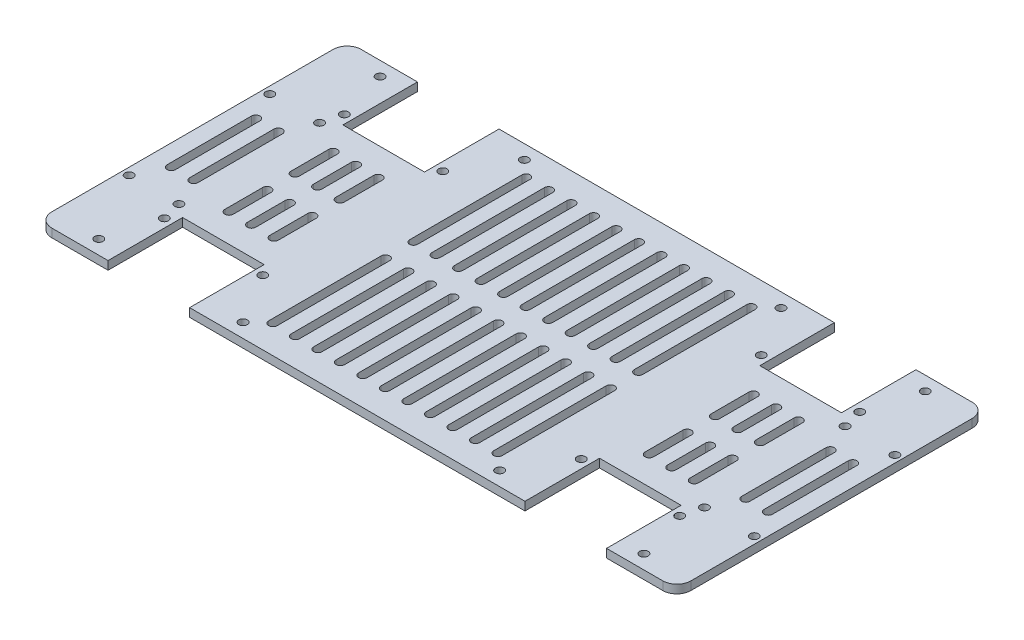
from build123d import *

# Parameters (mm, degrees)
SKETCH_1_R      = 1.5
EXTRUDE_2_DEPTH = 3
FILLET_1_R      = 5


with BuildPart() as part:
    # 草图1 → 凸台-拉伸2 (new body)
    with BuildSketch(Plane(origin=(0, 0, 0), x_dir=(1, 0, 0), z_dir=(0, 1, 0))):
        Polygon((-51.097347914, -170.742252719), (-51.097347914, -197.242252719), (68.132652086, -197.242252719), (68.132652086, -170.742252719), (97.132652086, -170.742252719), (97.132652086, -197.242252719), (122.132652086, -197.242252719), (122.132652086, -87.242252719), (97.132652086, -87.242252719), (97.132652086, -113.742252719), (68.132652086, -113.742252719), (68.132652086, -87.242252719), (-51.097347914, -87.242252719), (-51.097347914, -113.742252719), (-80.097347914, -113.742252719), (-80.097347914, -87.242252719), (-105.097347914, -87.242252719), (-105.097347914, -197.242252719), (-80.097347914, -197.242252719), (-80.097347914, -170.742252719), align=None)
        with Locations(Location((-88.387347914, -192.242252719, 0), (0, 0, 270))):
            Circle(SKETCH_1_R, mode=Mode.SUBTRACT)
        with Locations(Location((-37.097347914, -192.242252719, 0), (0, 0, 270))):
            Circle(SKETCH_1_R, mode=Mode.SUBTRACT)
        with Locations(Location((-102.597347914, -167.242252719, 0), (0, 0, 270))):
            Circle(SKETCH_1_R, mode=Mode.SUBTRACT)
        with Locations(Location((-84.897347914, -167.242252719, 0), (0, 0, 270))):
            Circle(SKETCH_1_R, mode=Mode.SUBTRACT)
        with BuildLine():
            ThreePointArc((-75.097347914, -147.242252719), (-73.597347914, -145.742252719), (-72.097347914, -147.242252719))
            Line((-72.097347914, -147.242252719), (-72.097347914, -160.742252719))
            ThreePointArc((-72.097347914, -160.742252719), (-73.597347914, -162.242252719), (-75.097347914, -160.742252719))
            Line((-75.097347914, -160.742252719), (-75.097347914, -147.242252719))
        make_face(mode=Mode.SUBTRACT)
        with BuildLine():
            ThreePointArc((-67.097347914, -147.242252719), (-65.597347914, -145.742252719), (-64.097347914, -147.242252719))
            Line((-64.097347914, -147.242252719), (-64.097347914, -160.742252719))
            ThreePointArc((-64.097347914, -160.742252719), (-65.597347914, -162.242252719), (-67.097347914, -160.742252719))
            Line((-67.097347914, -160.742252719), (-67.097347914, -147.242252719))
        make_face(mode=Mode.SUBTRACT)
        with BuildLine():
            ThreePointArc((-59.097347914, -147.242252719), (-57.597347914, -145.742252719), (-56.097347914, -147.242252719))
            Line((-56.097347914, -147.242252719), (-56.097347914, -160.742252719))
            ThreePointArc((-56.097347914, -160.742252719), (-57.597347914, -162.242252719), (-59.097347914, -160.742252719))
            Line((-59.097347914, -160.742252719), (-59.097347914, -147.242252719))
        make_face(mode=Mode.SUBTRACT)
        with BuildLine():
            ThreePointArc((-32.982347914, -147.242252719), (-31.482347914, -145.742252719), (-29.982347914, -147.242252719))
            Line((-29.982347914, -147.242252719), (-29.982347914, -187.242252719))
            ThreePointArc((-29.982347914, -187.242252719), (-31.482347914, -188.742252719), (-32.982347914, -187.242252719))
            Line((-32.982347914, -187.242252719), (-32.982347914, -147.242252719))
        make_face(mode=Mode.SUBTRACT)
        with BuildLine():
            ThreePointArc((-24.982347914, -147.242252719), (-23.482347914, -145.742252719), (-21.982347914, -147.242252719))
            Line((-21.982347914, -147.242252719), (-21.982347914, -187.242252719))
            ThreePointArc((-21.982347914, -187.242252719), (-23.482347914, -188.742252719), (-24.982347914, -187.242252719))
            Line((-24.982347914, -187.242252719), (-24.982347914, -147.242252719))
        make_face(mode=Mode.SUBTRACT)
        with BuildLine():
            ThreePointArc((-16.982347914, -147.242252719), (-15.482347914, -145.742252719), (-13.982347914, -147.242252719))
            Line((-13.982347914, -147.242252719), (-13.982347914, -187.242252719))
            ThreePointArc((-13.982347914, -187.242252719), (-15.482347914, -188.742252719), (-16.982347914, -187.242252719))
            Line((-16.982347914, -187.242252719), (-16.982347914, -147.242252719))
        make_face(mode=Mode.SUBTRACT)
        with BuildLine():
            ThreePointArc((-8.982347914, -147.242252719), (-7.482347914, -145.742252719), (-5.982347914, -147.242252719))
            Line((-5.982347914, -147.242252719), (-5.982347914, -187.242252719))
            ThreePointArc((-5.982347914, -187.242252719), (-7.482347914, -188.742252719), (-8.982347914, -187.242252719))
            Line((-8.982347914, -187.242252719), (-8.982347914, -147.242252719))
        make_face(mode=Mode.SUBTRACT)
        with BuildLine():
            ThreePointArc((-0.982347914, -147.242252719), (0.517652086, -145.742252719), (2.017652086, -147.242252719))
            Line((2.017652086, -147.242252719), (2.017652086, -187.242252719))
            ThreePointArc((2.017652086, -187.242252719), (0.517652086, -188.742252719), (-0.982347914, -187.242252719))
            Line((-0.982347914, -187.242252719), (-0.982347914, -147.242252719))
        make_face(mode=Mode.SUBTRACT)
        with Locations(Location((54.132652086, -192.242252719, 0), (0, 0, 270))):
            Circle(SKETCH_1_R, mode=Mode.SUBTRACT)
        with Locations(Location((105.422652086, -192.242252719, 0), (0, 0, 270))):
            Circle(SKETCH_1_R, mode=Mode.SUBTRACT)
        with BuildLine():
            ThreePointArc((7.017652086, -147.242252719), (8.517652086, -145.742252719), (10.017652086, -147.242252719))
            Line((10.017652086, -147.242252719), (10.017652086, -187.242252719))
            ThreePointArc((10.017652086, -187.242252719), (8.517652086, -188.742252719), (7.017652086, -187.242252719))
            Line((7.017652086, -187.242252719), (7.017652086, -147.242252719))
        make_face(mode=Mode.SUBTRACT)
        with BuildLine():
            ThreePointArc((15.017652086, -147.242252719), (16.517652086, -145.742252719), (18.017652086, -147.242252719))
            Line((18.017652086, -147.242252719), (18.017652086, -187.242252719))
            ThreePointArc((18.017652086, -187.242252719), (16.517652086, -188.742252719), (15.017652086, -187.242252719))
            Line((15.017652086, -187.242252719), (15.017652086, -147.242252719))
        make_face(mode=Mode.SUBTRACT)
        with BuildLine():
            ThreePointArc((23.017652086, -147.242252719), (24.517652086, -145.742252719), (26.017652086, -147.242252719))
            Line((26.017652086, -147.242252719), (26.017652086, -187.242252719))
            ThreePointArc((26.017652086, -187.242252719), (24.517652086, -188.742252719), (23.017652086, -187.242252719))
            Line((23.017652086, -187.242252719), (23.017652086, -147.242252719))
        make_face(mode=Mode.SUBTRACT)
        with BuildLine():
            ThreePointArc((31.017652086, -147.242252719), (32.517652086, -145.742252719), (34.017652086, -147.242252719))
            Line((34.017652086, -147.242252719), (34.017652086, -187.242252719))
            ThreePointArc((34.017652086, -187.242252719), (32.517652086, -188.742252719), (31.017652086, -187.242252719))
            Line((31.017652086, -187.242252719), (31.017652086, -147.242252719))
        make_face(mode=Mode.SUBTRACT)
        with BuildLine():
            ThreePointArc((39.017652086, -147.242252719), (40.517652086, -145.742252719), (42.017652086, -147.242252719))
            Line((42.017652086, -147.242252719), (42.017652086, -187.242252719))
            ThreePointArc((42.017652086, -187.242252719), (40.517652086, -188.742252719), (39.017652086, -187.242252719))
            Line((39.017652086, -187.242252719), (39.017652086, -147.242252719))
        make_face(mode=Mode.SUBTRACT)
        with BuildLine():
            ThreePointArc((47.017652086, -147.242252719), (48.517652086, -145.742252719), (50.017652086, -147.242252719))
            Line((50.017652086, -147.242252719), (50.017652086, -187.242252719))
            ThreePointArc((50.017652086, -187.242252719), (48.517652086, -188.742252719), (47.017652086, -187.242252719))
            Line((47.017652086, -187.242252719), (47.017652086, -147.242252719))
        make_face(mode=Mode.SUBTRACT)
        with Locations(Location((101.932652086, -167.242252719, 0), (0, 0, 270))):
            Circle(SKETCH_1_R, mode=Mode.SUBTRACT)
        with Locations(Location((119.632652086, -167.242252719, 0), (0, 0, 270))):
            Circle(SKETCH_1_R, mode=Mode.SUBTRACT)
        with BuildLine():
            ThreePointArc((74.308572238, -147.242252719), (75.808572238, -145.742252719), (77.308572238, -147.242252719))
            Line((77.308572238, -147.242252719), (77.308572238, -160.742252719))
            ThreePointArc((77.308572238, -160.742252719), (75.808572238, -162.242252719), (74.308572238, -160.742252719))
            Line((74.308572238, -160.742252719), (74.308572238, -147.242252719))
        make_face(mode=Mode.SUBTRACT)
        with BuildLine():
            ThreePointArc((82.308572238, -147.242252719), (83.808572238, -145.742252719), (85.308572238, -147.242252719))
            Line((85.308572238, -147.242252719), (85.308572238, -160.742252719))
            ThreePointArc((85.308572238, -160.742252719), (83.808572238, -162.242252719), (82.308572238, -160.742252719))
            Line((82.308572238, -160.742252719), (82.308572238, -147.242252719))
        make_face(mode=Mode.SUBTRACT)
        with BuildLine():
            ThreePointArc((90.308572238, -147.242252719), (91.808572238, -145.742252719), (93.308572238, -147.242252719))
            Line((93.308572238, -147.242252719), (93.308572238, -160.742252719))
            ThreePointArc((93.308572238, -160.742252719), (91.808572238, -162.242252719), (90.308572238, -160.742252719))
            Line((90.308572238, -160.742252719), (90.308572238, -147.242252719))
        make_face(mode=Mode.SUBTRACT)
        with BuildLine():
            ThreePointArc((105.132652086, -127.242252719), (106.632652086, -125.742252719), (108.132652086, -127.242252719))
            Line((108.132652086, -127.242252719), (108.132652086, -157.242252719))
            ThreePointArc((108.132652086, -157.242252719), (106.632652086, -158.742252719), (105.132652086, -157.242252719))
            Line((105.132652086, -157.242252719), (105.132652086, -127.242252719))
        make_face(mode=Mode.SUBTRACT)
        with BuildLine():
            ThreePointArc((113.132652086, -127.242252719), (114.632652086, -125.742252719), (116.132652086, -127.242252719))
            Line((116.132652086, -127.242252719), (116.132652086, -157.242252719))
            ThreePointArc((116.132652086, -157.242252719), (114.632652086, -158.742252719), (113.132652086, -157.242252719))
            Line((113.132652086, -157.242252719), (113.132652086, -127.242252719))
        make_face(mode=Mode.SUBTRACT)
        with BuildLine():
            ThreePointArc((-99.097347914, -127.242252719), (-97.597347914, -125.742252719), (-96.097347914, -127.242252719))
            Line((-96.097347914, -127.242252719), (-96.097347914, -157.242252719))
            ThreePointArc((-96.097347914, -157.242252719), (-97.597347914, -158.742252719), (-99.097347914, -157.242252719))
            Line((-99.097347914, -157.242252719), (-99.097347914, -127.242252719))
        make_face(mode=Mode.SUBTRACT)
        with BuildLine():
            ThreePointArc((-91.097347914, -127.242252719), (-89.597347914, -125.742252719), (-88.097347914, -127.242252719))
            Line((-88.097347914, -127.242252719), (-88.097347914, -157.242252719))
            ThreePointArc((-88.097347914, -157.242252719), (-89.597347914, -158.742252719), (-91.097347914, -157.242252719))
            Line((-91.097347914, -157.242252719), (-91.097347914, -127.242252719))
        make_face(mode=Mode.SUBTRACT)
        with BuildLine():
            ThreePointArc((-72.097347914, -137.242252719), (-73.597347914, -138.742252719), (-75.097347914, -137.242252719))
            Line((-75.097347914, -137.242252719), (-75.097347914, -123.742252719))
            ThreePointArc((-75.097347914, -123.742252719), (-73.597347914, -122.242252719), (-72.097347914, -123.742252719))
            Line((-72.097347914, -123.742252719), (-72.097347914, -137.242252719))
        make_face(mode=Mode.SUBTRACT)
        with BuildLine():
            ThreePointArc((-64.097347914, -137.242252719), (-65.597347914, -138.742252719), (-67.097347914, -137.242252719))
            Line((-67.097347914, -137.242252719), (-67.097347914, -123.742252719))
            ThreePointArc((-67.097347914, -123.742252719), (-65.597347914, -122.242252719), (-64.097347914, -123.742252719))
            Line((-64.097347914, -123.742252719), (-64.097347914, -137.242252719))
        make_face(mode=Mode.SUBTRACT)
        with BuildLine():
            ThreePointArc((-56.097347914, -137.242252719), (-57.597347914, -138.742252719), (-59.097347914, -137.242252719))
            Line((-59.097347914, -137.242252719), (-59.097347914, -123.742252719))
            ThreePointArc((-59.097347914, -123.742252719), (-57.597347914, -122.242252719), (-56.097347914, -123.742252719))
            Line((-56.097347914, -123.742252719), (-56.097347914, -137.242252719))
        make_face(mode=Mode.SUBTRACT)
        with Locations(Location((-102.597347914, -117.242252719, 0), (0, 0, 270))):
            Circle(SKETCH_1_R, mode=Mode.SUBTRACT)
        with Locations(Location((-84.897347914, -117.242252719, 0), (0, 0, 270))):
            Circle(SKETCH_1_R, mode=Mode.SUBTRACT)
        with BuildLine():
            ThreePointArc((-32.899486364, -97.242252719), (-31.482347914, -95.825114269), (-30.065209464, -97.242252719))
            Line((-30.065209464, -97.242252719), (-30.065209464, -137.242252719))
            ThreePointArc((-30.065209464, -137.242252719), (-31.482347914, -138.659391169), (-32.899486364, -137.242252719))
            Line((-32.899486364, -137.242252719), (-32.899486364, -97.242252719))
        make_face(mode=Mode.SUBTRACT)
        with BuildLine():
            ThreePointArc((-24.982347914, -97.242252719), (-23.482347914, -95.742252719), (-21.982347914, -97.242252719))
            Line((-21.982347914, -97.242252719), (-21.982347914, -137.242252719))
            ThreePointArc((-21.982347914, -137.242252719), (-23.482347914, -138.742252719), (-24.982347914, -137.242252719))
            Line((-24.982347914, -137.242252719), (-24.982347914, -97.242252719))
        make_face(mode=Mode.SUBTRACT)
        with BuildLine():
            ThreePointArc((-16.982347914, -97.242252719), (-15.482347914, -95.742252719), (-13.982347914, -97.242252719))
            Line((-13.982347914, -97.242252719), (-13.982347914, -137.242252719))
            ThreePointArc((-13.982347914, -137.242252719), (-15.482347914, -138.742252719), (-16.982347914, -137.242252719))
            Line((-16.982347914, -137.242252719), (-16.982347914, -97.242252719))
        make_face(mode=Mode.SUBTRACT)
        with BuildLine():
            ThreePointArc((-8.982347914, -97.242252719), (-7.482347914, -95.742252719), (-5.982347914, -97.242252719))
            Line((-5.982347914, -97.242252719), (-5.982347914, -137.242252719))
            ThreePointArc((-5.982347914, -137.242252719), (-7.482347914, -138.742252719), (-8.982347914, -137.242252719))
            Line((-8.982347914, -137.242252719), (-8.982347914, -97.242252719))
        make_face(mode=Mode.SUBTRACT)
        with BuildLine():
            ThreePointArc((-0.982347914, -97.242252719), (0.517652086, -95.742252719), (2.017652086, -97.242252719))
            Line((2.017652086, -97.242252719), (2.017652086, -137.242252719))
            ThreePointArc((2.017652086, -137.242252719), (0.517652086, -138.742252719), (-0.982347914, -137.242252719))
            Line((-0.982347914, -137.242252719), (-0.982347914, -97.242252719))
        make_face(mode=Mode.SUBTRACT)
        with Locations(Location((-88.387347914, -92.242252719, 0), (0, 0, 270))):
            Circle(SKETCH_1_R, mode=Mode.SUBTRACT)
        with Locations(Location((-37.097347914, -92.242252719, 0), (0, 0, 270))):
            Circle(SKETCH_1_R, mode=Mode.SUBTRACT)
        with BuildLine():
            ThreePointArc((7.017652086, -97.242252719), (8.517652086, -95.742252719), (10.017652086, -97.242252719))
            Line((10.017652086, -97.242252719), (10.017652086, -137.242252719))
            ThreePointArc((10.017652086, -137.242252719), (8.517652086, -138.742252719), (7.017652086, -137.242252719))
            Line((7.017652086, -137.242252719), (7.017652086, -97.242252719))
        make_face(mode=Mode.SUBTRACT)
        with BuildLine():
            ThreePointArc((15.017652086, -97.242252719), (16.517652086, -95.742252719), (18.017652086, -97.242252719))
            Line((18.017652086, -97.242252719), (18.017652086, -137.242252719))
            ThreePointArc((18.017652086, -137.242252719), (16.517652086, -138.742252719), (15.017652086, -137.242252719))
            Line((15.017652086, -137.242252719), (15.017652086, -97.242252719))
        make_face(mode=Mode.SUBTRACT)
        with BuildLine():
            ThreePointArc((23.017652086, -97.242252719), (24.517652086, -95.742252719), (26.017652086, -97.242252719))
            Line((26.017652086, -97.242252719), (26.017652086, -137.242252719))
            ThreePointArc((26.017652086, -137.242252719), (24.517652086, -138.742252719), (23.017652086, -137.242252719))
            Line((23.017652086, -137.242252719), (23.017652086, -97.242252719))
        make_face(mode=Mode.SUBTRACT)
        with BuildLine():
            ThreePointArc((31.017652086, -97.242252719), (32.517652086, -95.742252719), (34.017652086, -97.242252719))
            Line((34.017652086, -97.242252719), (34.017652086, -137.242252719))
            ThreePointArc((34.017652086, -137.242252719), (32.517652086, -138.742252719), (31.017652086, -137.242252719))
            Line((31.017652086, -137.242252719), (31.017652086, -97.242252719))
        make_face(mode=Mode.SUBTRACT)
        with BuildLine():
            ThreePointArc((39.017652086, -97.242252719), (40.517652086, -95.742252719), (42.017652086, -97.242252719))
            Line((42.017652086, -97.242252719), (42.017652086, -137.242252719))
            ThreePointArc((42.017652086, -137.242252719), (40.517652086, -138.742252719), (39.017652086, -137.242252719))
            Line((39.017652086, -137.242252719), (39.017652086, -97.242252719))
        make_face(mode=Mode.SUBTRACT)
        with BuildLine():
            ThreePointArc((47.017652086, -97.242252719), (48.517652086, -95.742252719), (50.017652086, -97.242252719))
            Line((50.017652086, -97.242252719), (50.017652086, -137.242252719))
            ThreePointArc((50.017652086, -137.242252719), (48.517652086, -138.742252719), (47.017652086, -137.242252719))
            Line((47.017652086, -137.242252719), (47.017652086, -97.242252719))
        make_face(mode=Mode.SUBTRACT)
        with BuildLine():
            ThreePointArc((74.308572238, -123.742252719), (75.808572238, -122.242252719), (77.308572238, -123.742252719))
            Line((77.308572238, -123.742252719), (77.308572238, -137.242252719))
            ThreePointArc((77.308572238, -137.242252719), (75.808572238, -138.742252719), (74.308572238, -137.242252719))
            Line((74.308572238, -137.242252719), (74.308572238, -123.742252719))
        make_face(mode=Mode.SUBTRACT)
        with BuildLine():
            ThreePointArc((82.308572238, -123.742252719), (83.808572238, -122.242252719), (85.308572238, -123.742252719))
            Line((85.308572238, -123.742252719), (85.308572238, -137.242252719))
            ThreePointArc((85.308572238, -137.242252719), (83.808572238, -138.742252719), (82.308572238, -137.242252719))
            Line((82.308572238, -137.242252719), (82.308572238, -123.742252719))
        make_face(mode=Mode.SUBTRACT)
        with BuildLine():
            ThreePointArc((90.308572238, -123.742252719), (91.808572238, -122.242252719), (93.308572238, -123.742252719))
            Line((93.308572238, -123.742252719), (93.308572238, -137.242252719))
            ThreePointArc((93.308572238, -137.242252719), (91.808572238, -138.742252719), (90.308572238, -137.242252719))
            Line((90.308572238, -137.242252719), (90.308572238, -123.742252719))
        make_face(mode=Mode.SUBTRACT)
        with Locations(Location((101.932652086, -117.242252719, 0), (0, 0, 270))):
            Circle(SKETCH_1_R, mode=Mode.SUBTRACT)
        with Locations(Location((119.632652086, -117.242252719, 0), (0, 0, 270))):
            Circle(SKETCH_1_R, mode=Mode.SUBTRACT)
        with Locations(Location((54.132652086, -92.242252719, 0), (0, 0, 270))):
            Circle(SKETCH_1_R, mode=Mode.SUBTRACT)
        with Locations(Location((105.422652086, -92.242252719, 0), (0, 0, 270))):
            Circle(SKETCH_1_R, mode=Mode.SUBTRACT)
        with Locations(Location((-48.097347914, -174.242252719, 0), (0, 0, 270))):
            Circle(SKETCH_1_R, mode=Mode.SUBTRACT)
        with Locations(Location((-83.097347914, -174.242252719, 0), (0, 0, 270))):
            Circle(SKETCH_1_R, mode=Mode.SUBTRACT)
        with Locations(Location((65.132652086, -174.242252719, 0), (0, 0, 270))):
            Circle(SKETCH_1_R, mode=Mode.SUBTRACT)
        with Locations(Location((100.132652086, -174.242252719, 0), (0, 0, 270))):
            Circle(SKETCH_1_R, mode=Mode.SUBTRACT)
        with Locations(Location((-83.097347914, -110.242252719, 0), (0, 0, 270))):
            Circle(SKETCH_1_R, mode=Mode.SUBTRACT)
        with Locations(Location((-48.097347914, -110.242252719, 0), (0, 0, 270))):
            Circle(SKETCH_1_R, mode=Mode.SUBTRACT)
        with Locations(Location((100.132652086, -110.242252719, 0), (0, 0, 270))):
            Circle(SKETCH_1_R, mode=Mode.SUBTRACT)
        with Locations(Location((65.132652086, -110.242252719, 0), (0, 0, 270))):
            Circle(SKETCH_1_R, mode=Mode.SUBTRACT)
    extrude(amount=EXTRUDE_2_DEPTH)

    # 圆角1
    fillet_1_edges = [part.edges().sort_by_distance(p)[0] for p in [
        (-105.097347914, 1.5, 197.242252719),
        (-105.097347914, 1.5, 87.242252719),
        (122.132652086, 1.5, 87.242252719),
        (122.132652086, 1.5, 197.242252719),
    ]]
    fillet(fillet_1_edges, radius=FILLET_1_R)


solid = part.part
